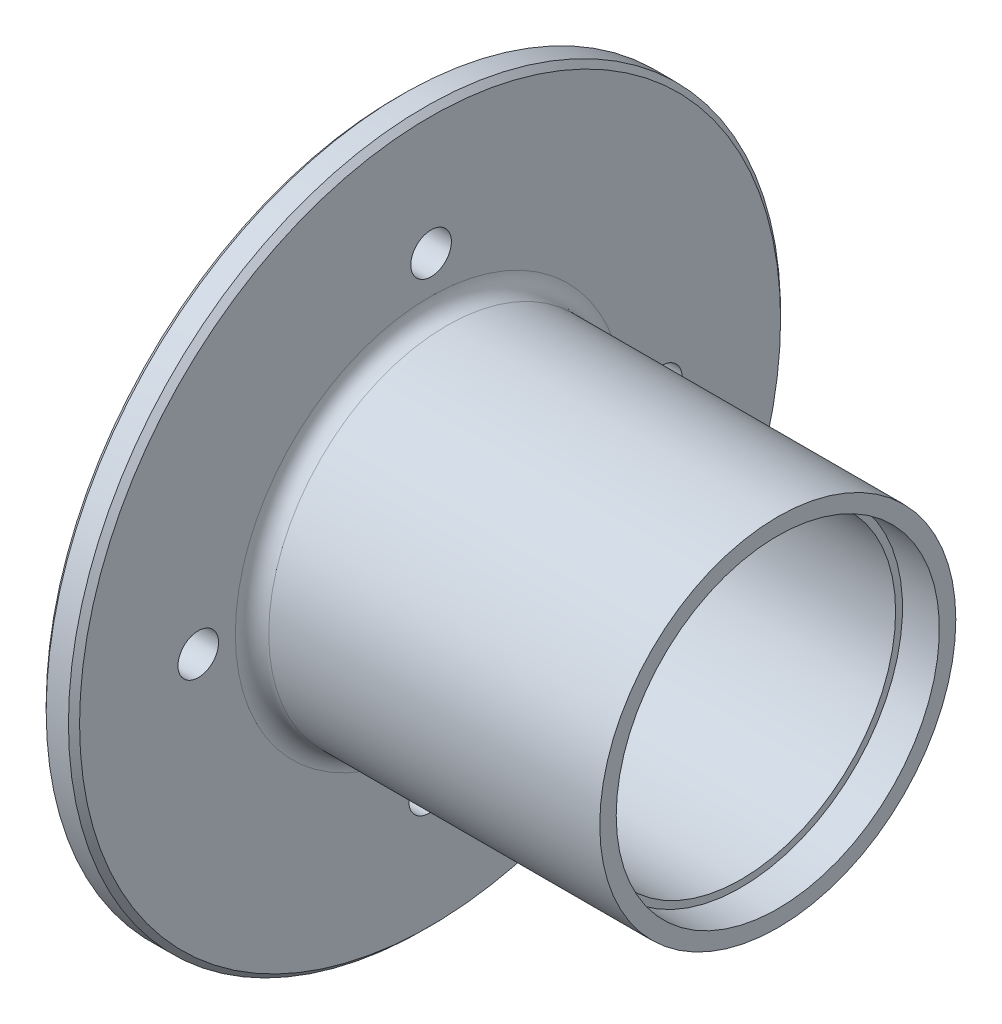
from build123d import *

# Parameters (mm, degrees)
F_12_CLEARANCE_HOLE1_D = 5.7912
CIRPATTERN1_COUNT      = 4


with BuildPart() as part:
    # Sketch1 → Revolve1 (revolve)
    with BuildSketch(Plane.XY):
        with BuildLine():
            Line((4.7625, 12.547042688), (4.7625, 17.143351136))
            Line((4.7625, 17.143351136), (20.20283565, 17.143351136))
            Line((20.20283565, 17.143351136), (20.20283565, 22.067968078))
            Line((20.20283565, 22.067968078), (49.112399892, 22.067968078))
            Line((49.112399892, 22.067968078), (49.112399892, 23.05289127))
            Line((49.112399892, 23.05289127), (54.368684681, 23.05289127))
            Line((54.368684681, 23.05289127), (54.368684681, 25.4))
            Line((54.368684681, 25.4), (7.14375, 25.4))
            ThreePointArc((7.14375, 25.4), (5.459951977, 26.097451977), (4.7625, 27.78125))
            Line((4.7625, 27.78125), (4.7625, 50.00625))
            Line((4.7625, 50.00625), (3.96875, 50.8))
            Line((3.96875, 50.8), (0.79375, 50.8))
            Line((0.79375, 50.8), (0, 50.00625))
            Line((0, 50.00625), (0, 17.143351136))
            Line((0, 17.143351136), (4.7625, 12.547042688))
        make_face()
    revolve(axis=Axis((207.498884421, 0, 0), (1, 0, 0)))

    # #12 Clearance Hole1 (through all)
    with Locations(Plane(origin=(0, 33.069002249, -0.146973343), x_dir=(0, 0, -1), z_dir=(-1, 0, 0))):
        with Locations((0, 0)):
            f_12_clearance_hole1 = Hole(F_12_CLEARANCE_HOLE1_D / 2)

    # CirPattern1: #12 Clearance Hole1 ×4 about axis
    cirpattern1_axis = Axis((54.368684681, 0, 0), (-1, 0, 0))
    for i in range(1, CIRPATTERN1_COUNT):
        add(f_12_clearance_hole1.rotate(cirpattern1_axis, i * 360 / CIRPATTERN1_COUNT), mode=Mode.SUBTRACT)


solid = part.part
